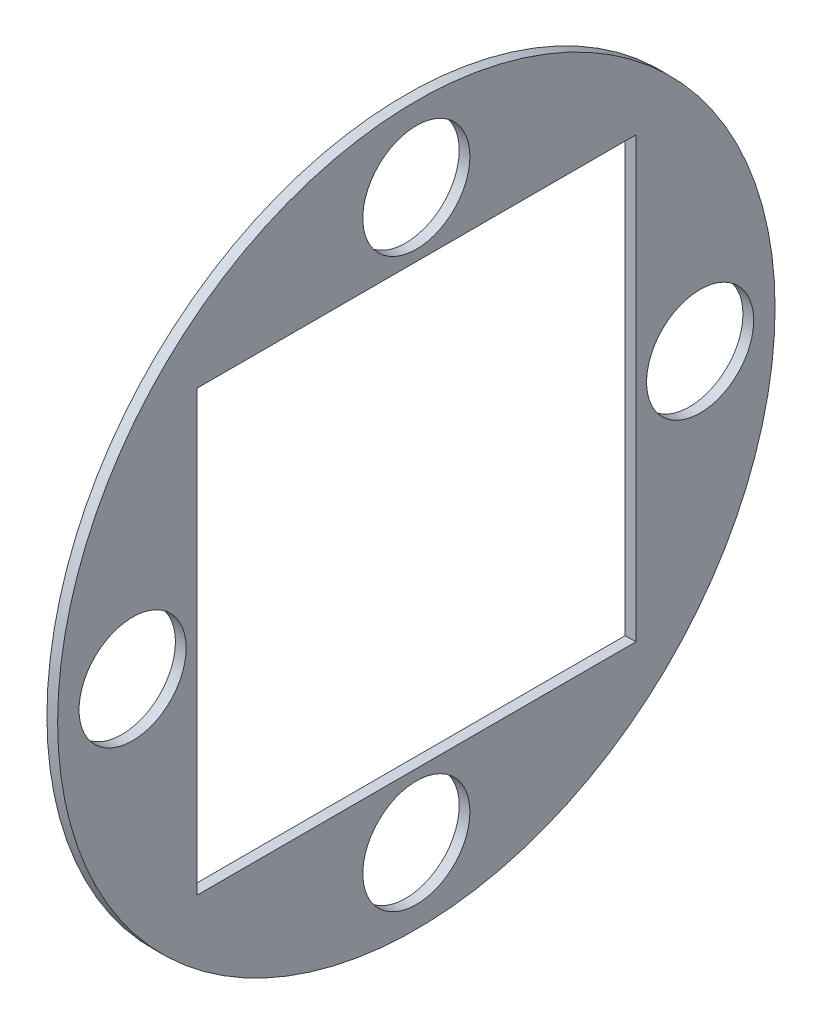
from build123d import *

# Parameters (mm, degrees)
SKETCH2_R           = 85.09
SKETCH2_R_2         = 12.7
SKETCH2_W           = 104.14
SKETCH2_H           = 104.14
BOSS_EXTRUDE1_DEPTH = 2.54


with BuildPart() as part:
    # Sketch2 → Boss-Extrude1 (new body)
    with BuildSketch(Plane.YZ):
        with Locations(Location((0, 0, 0), (0, 0, 270))):
            Circle(SKETCH2_R)
        with Locations(Location((0, 67.31, 0), (0, 0, 270))):
            Circle(SKETCH2_R_2, mode=Mode.SUBTRACT)
        with Locations(Location((67.31, 0, 0), (0, 0, 270))):
            Circle(SKETCH2_R_2, mode=Mode.SUBTRACT)
        with Locations(Location((0, -67.31, 0), (0, 0, 270))):
            Circle(SKETCH2_R_2, mode=Mode.SUBTRACT)
        with Locations(Location((-67.31, 0, 0), (0, 0, 270))):
            Circle(SKETCH2_R_2, mode=Mode.SUBTRACT)
        Rectangle(SKETCH2_W, SKETCH2_H, mode=Mode.SUBTRACT)
    extrude(amount=BOSS_EXTRUDE1_DEPTH)


solid = part.part
